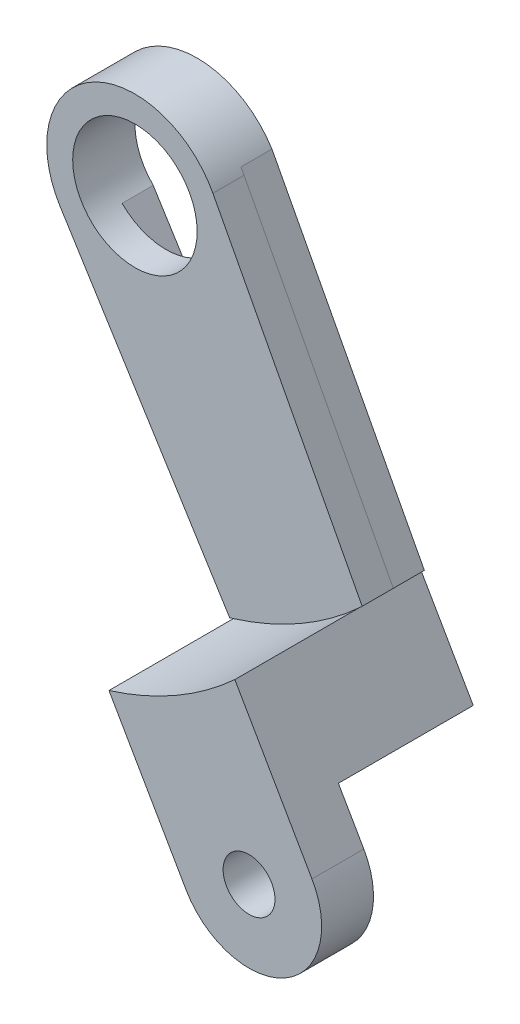
from build123d import *
from build123d.topology import SkipClean

# Parameters (mm, degrees)
SKIZZE1_R                       = 2.5
AUFSATZ_LINEAR_AUSTRAGEN1_DEPTH = 5
AUFSATZ_LINEAR_START            = 7
AUFSATZ_LINEAR_AUSTRAGEN2_DEPTH = 7
AUFSATZ_LINEAR_START_2          = 3
SKIZZE3_R                       = 6
AUFSATZ_LINEAR_AUSTRAGEN3_DEPTH = 3
BOSS_EXTRUDE1_START             = 3
BOSS_EXTRUDE1_DEPTH             = 3


with BuildPart() as part:
    # Skizze1 → Aufsatz-Linear austragen1 (new body)
    with BuildSketch(Plane.XY):
        with BuildLine():
            ThreePointArc((-6.068344121, -3.48929787), (3.48929787, -6.068344121), (6.068344121, 3.48929787))
            Line((6.068344121, 3.48929787), (-1.366900012, 16.420157233))
            ThreePointArc((-1.366900012, 16.420157233), (-7.048924024, 12.258998302), (-13.503588255, 9.441561493))
            Line((-13.503588255, 9.441561493), (-6.068344121, -3.48929787))
        make_face()
        Circle(SKIZZE1_R, mode=Mode.SUBTRACT)
    extrude(amount=AUFSATZ_LINEAR_AUSTRAGEN1_DEPTH)

    # Skizze2 → Aufsatz-Linear austragen2 (add)
    with BuildSketch(Plane(origin=(0, 0, 0), x_dir=(-1, 0, 0), z_dir=(0, 0, -1)).offset(AUFSATZ_LINEAR_START)):
        with BuildLine():
            Line((8.518877013, 0.772498463), (13.503588255, 9.441561493))
            ThreePointArc((13.503588255, 9.441561493), (7.048924023, 12.258998302), (1.366900012, 16.420157232))
            Line((1.366900012, 16.420157233), (-3.61781123, 7.751094202))
            Line((-3.61781123, 7.751094202), (8.518877013, 0.772498463))
        make_face()
    extrude(amount=-AUFSATZ_LINEAR_AUSTRAGEN2_DEPTH)

    # Skizze3 → Aufsatz-Linear austragen3 (add)
    with BuildSketch(Plane(origin=(0, 0, -7), x_dir=(-1, 0, 0), z_dir=(0, 0, -1)).offset(AUFSATZ_LINEAR_START_2)):
        with BuildLine():
            Line((1.366900012, 16.420157233), (-3.61781123, 7.751094202))
            Line((-3.61781123, 7.751094202), (8.518877013, 0.772498463))
            Line((8.518877013, 0.772498463), (13.503588255, 9.441561493))
            ThreePointArc((13.503588255, 9.441561493), (13.684230172, 9.386009203), (13.865197027, 9.331524742))
            Line((13.865197027, 9.331524742), (30.209148043, 35.496869479))
            ThreePointArc((30.209148043, 35.496869479), (27.237004556, 47.368703576), (15.481560492, 43.965232321))
            Line((15.481560492, 43.965232321), (1.089891738, 16.677325284))
            ThreePointArc((1.089891738, 16.677325284), (1.228016167, 16.548332256), (1.366900012, 16.420157233))
        make_face()
        with Locations((23, 40)):
            Circle(SKIZZE3_R, mode=Mode.SUBTRACT)
    extrude(amount=-AUFSATZ_LINEAR_AUSTRAGEN3_DEPTH)

    # Sketch1 → Boss-Extrude1 (add)
    with SkipClean():  # the faces are left unmerged after this step: merging them gives an invalid solid
        with BuildSketch(Plane(origin=(0, 0, -10), x_dir=(-1, 0, 0), z_dir=(0, 0, -1)).offset(BOSS_EXTRUDE1_START)):
            with BuildLine():
                ThreePointArc((24.687363033, 31.669165348), (27.842500084, 33.014286512), (30.209148043, 35.496869479))
                Line((30.209148043, 35.496869479), (28.088810383, 36.821319632))
                ThreePointArc((28.088810383, 36.821319632), (27.694055373, 36.262909667), (27.238322861, 35.753045877))
                Line((27.238322861, 35.753045877), (24.687363033, 31.669165348))
            make_face()
            with BuildLine():
                Line((13.865197027, 9.331524742), (30.209148043, 35.496869479))
                ThreePointArc((30.209148043, 35.496869479), (27.842500084, 33.014286512), (24.687363033, 31.669165348))
                Line((24.687363033, 31.669165348), (6.215378123, 2.097010324))
                Line((6.215378123, 2.097010324), (8.518877013, 0.772498463))
                Line((8.518877013, 0.772498463), (13.503588255, 9.441561493))
                ThreePointArc((13.503588255, 9.441561493), (13.684230172, 9.386009203), (13.865197027, 9.331524742))
            make_face()
            with BuildLine():
                Line((28.088810383, 36.821319632), (30.209148043, 35.496869479))
                ThreePointArc((30.209148043, 35.496869479), (31.170916667, 37.657753041), (31.5, 40))
                ThreePointArc((31.5, 40), (25.342246959, 48.170916667), (15.790851957, 44.503130521))
                Line((15.790851957, 44.503130521), (17.911189617, 43.178680368))
                ThreePointArc((17.911189617, 43.178680368), (24.653350795, 45.767705883), (29, 40))
                ThreePointArc((29, 40), (28.767705883, 38.346649205), (28.088810383, 36.821319632))
            make_face()
            with BuildLine():
                Line((17.911189617, 43.178680368), (15.790851957, 44.503130521))
                Line((15.790851957, 44.503130521), (15.216048877, 43.414689578))
                ThreePointArc((15.216048877, 43.414689578), (14.507527777, 40.35765281), (14.956507243, 37.25186895))
                Line((14.956507243, 37.25186895), (17.181735723, 41.465537717))
                ThreePointArc((17.181735723, 41.465537717), (17.479602927, 42.350577834), (17.911189617, 43.178680368))
            make_face()
            with BuildLine():
                Line((-1.32040378, 6.430084919), (14.956507243, 37.25186895))
                ThreePointArc((14.956507243, 37.25186895), (14.507527777, 40.35765281), (15.216048877, 43.414689578))
                Line((15.216048877, 43.414689578), (1.094048415, 16.673421058))
                ThreePointArc((1.094048415, 16.673421058), (1.230105912, 16.546392359), (1.366900012, 16.420157233))
                Line((1.366900012, 16.420157233), (-3.61781123, 7.751094202))
                Line((-3.61781123, 7.751094202), (-1.32040378, 6.430084919))
            make_face()
        extrude(amount=-BOSS_EXTRUDE1_DEPTH)


solid = part.part
